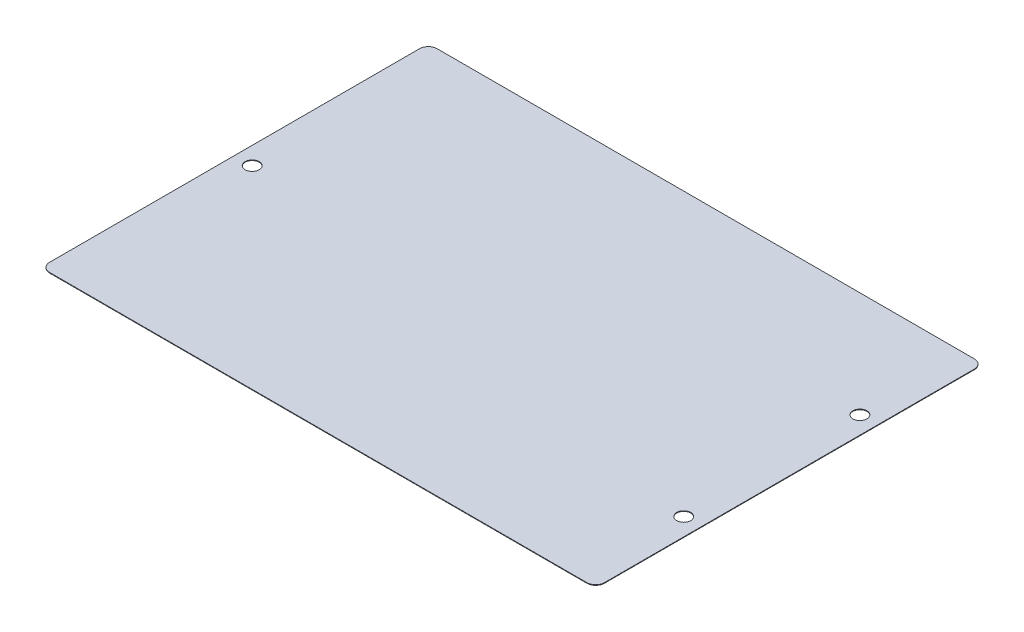
from build123d import *

# Parameters (mm, degrees)
SKETCH1_W           = 189
SKETCH1_H           = 132
SKETCH1_R           = 2.4
BOSS_EXTRUDE1_DEPTH = 0.2
FILLET1_R           = 3


with BuildPart() as part:
    # Sketch1 → Boss-Extrude1 (new body)
    with BuildSketch(Plane(origin=(0, 0, 0), x_dir=(1, 0, 0), z_dir=(0, 1, 0))):
        with Locations((94.5, 66)):
            Rectangle(SKETCH1_W, SKETCH1_H)
        with Locations(Location((6, 66, 0), (0, 0, 270))):
            Circle(SKETCH1_R, mode=Mode.SUBTRACT)
        with Locations(Location((183, 36, 0), (0, 0, 270))):
            Circle(SKETCH1_R, mode=Mode.SUBTRACT)
        with Locations(Location((183, 96, 0), (0, 0, 270))):
            Circle(SKETCH1_R, mode=Mode.SUBTRACT)
    extrude(amount=BOSS_EXTRUDE1_DEPTH)

    # Fillet1
    fillet1_edges = [part.edges().sort_by_distance(p)[0] for p in [
        (0, 0.1, -132),
        (189, 0.1, -132),
        (189, 0.1, 0),
        (0, 0.1, 0),
    ]]
    fillet(fillet1_edges, radius=FILLET1_R)


solid = part.part
